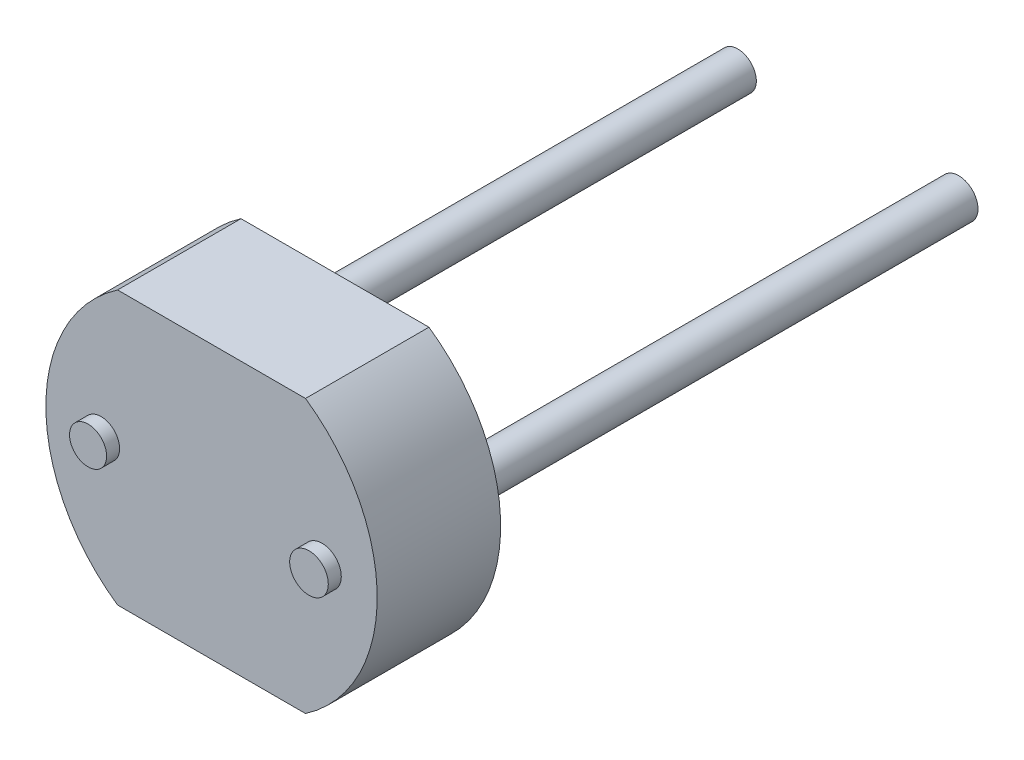
from build123d import *

# Parameters (mm, degrees)
RESSALTO_EXTRUS_O1_DEPTH = 1.9
ESBO_O3_R                = 0.297205441
ESBO_O3_R_2              = 0.285630525
RESSALTO_EXTRUS_O2_DEPTH = 10


with BuildPart() as part:
    # Esboço2 → Ressalto-extrusão1 (new body)
    with BuildSketch(Plane.XY):
        with BuildLine():
            Line((-1.446547614, -2.55), (1.446547614, -2.55))
            ThreePointArc((1.446547614, -2.55), (2.55, -0.45), (1.446547614, 1.65))
            Line((1.446547614, 1.65), (-1.446547614, 1.65))
            ThreePointArc((-1.446547614, 1.65), (-2.55, -0.45), (-1.446547614, -2.55))
        make_face()
    extrude(amount=RESSALTO_EXTRUS_O1_DEPTH)

    # Esboço3 → Ressalto-extrusão2 (add)
    with BuildSketch(Plane.XY.offset(2.1)):
        with Locations((1.7, -0.45)):
            Circle(ESBO_O3_R)
        with Locations((-1.7, -0.45)):
            Circle(ESBO_O3_R_2)
    extrude(amount=-RESSALTO_EXTRUS_O2_DEPTH)


solid = part.part
